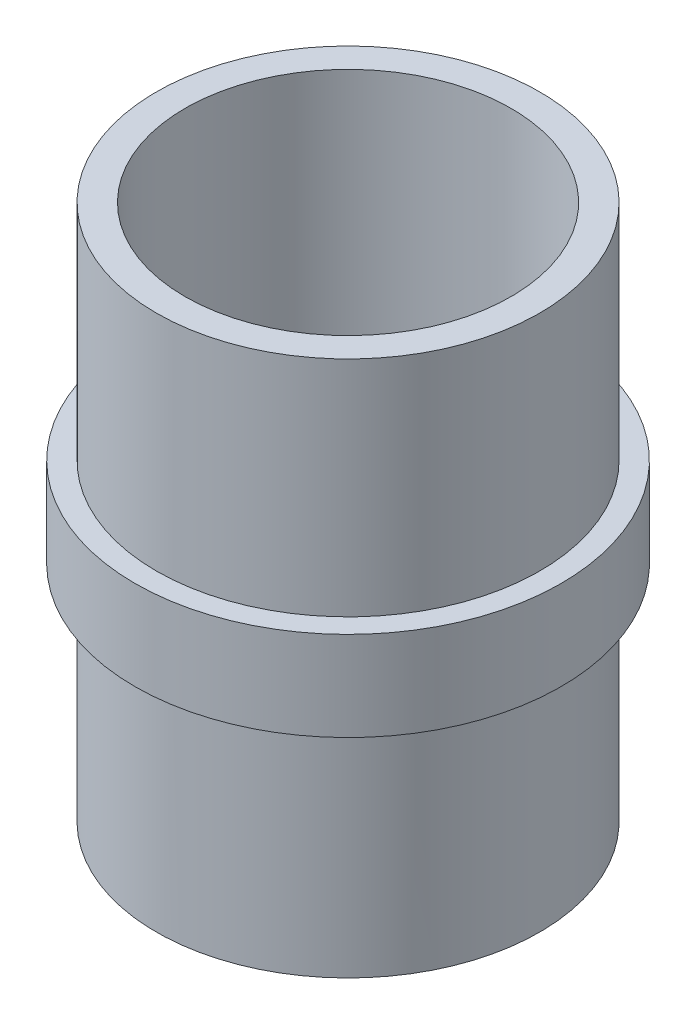
from build123d import *

# Parameters (mm, degrees)
SKETCH1_R                = 10.725
BOSS_EXTRUDE1_DEPTH      = 36
BOSS_EXTRUDE2_DEPTH      = 2.5
BOSS_EXTRUDE2_DEPTH_BACK = 2.5
SKETCH2_R                = 11.925
SKETCH3_R                = 9.125
CUT_EXTRUDE1_DEPTH       = 33
CUT_EXTRUDE2_START       = -3
SKETCH4_R                = 10.725
CUT_EXTRUDE2_DEPTH       = 3
SKETCH5_R                = 10.725
CUT_EXTRUDE3_DEPTH       = 3


with BuildPart() as part:
    # Sketch1 → Boss-Extrude1 (new body)
    with BuildSketch(Plane(origin=(0, 0, 0), x_dir=(1, 0, 0), z_dir=(0, 1, 0))):
        with Locations(Location((0, 0, 0), (0, 0, 270))):
            Circle(SKETCH1_R)
    extrude(amount=BOSS_EXTRUDE1_DEPTH)

    # Sketch2 → Boss-Extrude2 (add, two sides: drawn at the far end of the back side and taken through both)
    with BuildSketch(Plane(origin=(0, 18, 0), x_dir=(1, 0, 0), z_dir=(0, 1, 0)).offset(-BOSS_EXTRUDE2_DEPTH_BACK)):
        with Locations(Location((0, 0, 0), (0, 0, 270))):
            Circle(SKETCH2_R)
    extrude(amount=BOSS_EXTRUDE2_DEPTH + BOSS_EXTRUDE2_DEPTH_BACK)

    # Sketch3 → Cut-Extrude1 (cut)
    with BuildSketch(Plane(origin=(0, 36, 0), x_dir=(1, 0, 0), z_dir=(0, 1, 0))):
        with Locations(Location((0, 0, 0), (0, 0, 270))):
            Circle(SKETCH3_R)
    extrude(amount=-CUT_EXTRUDE1_DEPTH, mode=Mode.SUBTRACT)

    # Sketch4 → Cut-Extrude2 (cut)
    with BuildSketch(Plane(origin=(0, 36, 0), x_dir=(1, 0, 0), z_dir=(0, 1, 0)).offset(CUT_EXTRUDE2_START)):
        with Locations(Location((0, 0, 0), (0, 0, 270))):
            Circle(SKETCH4_R)
    extrude(amount=CUT_EXTRUDE2_DEPTH, mode=Mode.SUBTRACT)

    # Sketch5 → Cut-Extrude3 (cut)
    with BuildSketch(Plane.XZ):
        with Locations(Location((0, 0, 0), (0, 0, 270))):
            Circle(SKETCH5_R)
    extrude(amount=-CUT_EXTRUDE3_DEPTH, mode=Mode.SUBTRACT)


solid = part.part
